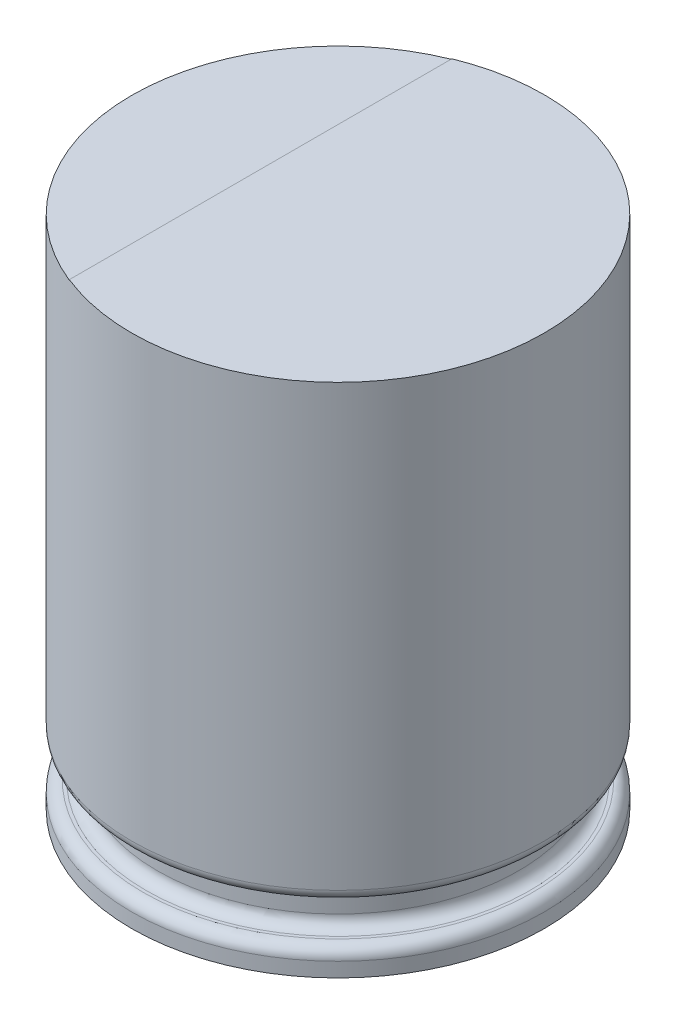
from build123d import *

# Parameters (mm, degrees)
CUT_EXTRUDE1_START = -0.01
CUT_EXTRUDE1_DEPTH = 0.01


with BuildPart() as part:
    # Sketch1 → Revolve1 (revolve)
    with BuildSketch(Plane.XY, mode=Mode.PRIVATE) as revolve1_sk:
        with BuildLine():
            Line((0, 0), (0, 10))
            Line((0, 10), (4, 10))
            Line((4, 10), (4, 1.47))
            ThreePointArc((4, 1.47), (3.935563492, 1.314436508), (3.78, 1.25))
            Line((3.78, 1.25), (3.72, 1.25))
            ThreePointArc((3.72, 1.25), (3.564436508, 1.185563492), (3.5, 1.03))
            Line((3.5, 1.03), (3.5, 0.72))
            ThreePointArc((3.5, 0.72), (3.564436508, 0.564436508), (3.72, 0.5))
            Line((3.72, 0.5), (3.78, 0.5))
            ThreePointArc((3.78, 0.5), (3.935563492, 0.435563492), (4, 0.28))
            Line((4, 0.28), (4, 0))
            Line((4, 0), (0, 0))
        make_face()
    revolve(revolve1_sk.sketch.rotate(Axis((0, 10, 0), (0, -1, 0)), 90), axis=Axis((0, 10, 0), (0, -1, 0)))

    # Sketch2 → Cut-Extrude1 (cut)
    with BuildSketch(Plane(origin=(0, 10, 0), x_dir=(1, 0, 0), z_dir=(0, 1, 0)).offset(CUT_EXTRUDE1_START)):
        with BuildLine():
            Line((-1.5, 3.708099244), (-1.5, -3.708099244))
            ThreePointArc((-1.5, -3.708099244), (-4, 0), (-1.5, 3.708099244))
        make_face()
    extrude(amount=CUT_EXTRUDE1_DEPTH, mode=Mode.SUBTRACT)


solid = part.part
